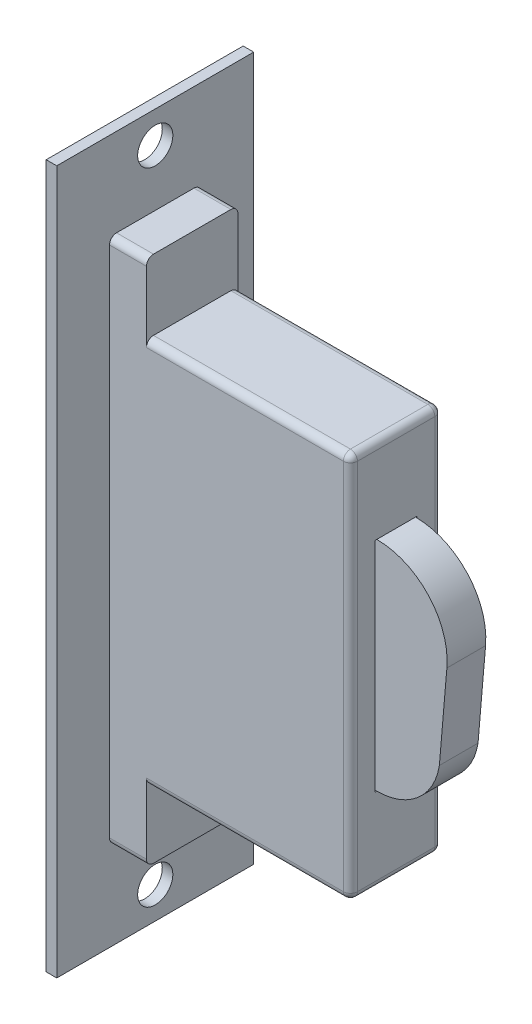
from build123d import *

# Parameters (mm, degrees)
EXTRUDE_1_DEPTH     = 6.5
SKETCH_2_W          = 28
SKETCH_2_H          = 100
SKETCH_2_R          = 2.5
EXTRUDE_2_DEPTH     = 0.75
SKETCH_3_W          = 6
SKETCH_3_H          = 31
CUT_EXTRUDE_1_DEPTH = 5
SKETCH_4_W          = 13.5
SKETCH_4_H          = 5.5
CUT_EXTRUDE_2_DEPTH = 5
EXTRUDE_3_DEPTH     = 2.75
FILLET_1_R          = 1
FILLET_2_R          = 1


with BuildPart() as part:
    # 草图1 → 凸台-拉伸1 (new, symmetric)
    with BuildSketch(Plane.XY):
        Polygon((0, 1.01114255), (0, 0), (35, 0), (35, 27.496864511), (6, 27.496864511), (6, 37.5), (0, 37.5), align=None)
        Polygon((35, 0), (0, 0), (0, -1.01114255), (0, -37.5), (6, -37.5), (6, -27.496864511), (35, -27.496864511), align=None)
    extrude(amount=EXTRUDE_1_DEPTH, both=True)

    # 草图2 → 凸台-拉伸2 (add, symmetric)
    with BuildSketch(Plane.ZY):
        Rectangle(SKETCH_2_W, SKETCH_2_H)
        with Locations(Location((0, -45.5, 0), (0, 0, 270))):
            Circle(SKETCH_2_R, mode=Mode.SUBTRACT)
        with Locations(Location((0, 45.5, 0), (0, 0, 90))):
            Circle(SKETCH_2_R, mode=Mode.SUBTRACT)
    extrude(amount=EXTRUDE_2_DEPTH, both=True)

    # 草图3 → 切除-拉伸1 (cut)
    with BuildSketch(Plane(origin=(35, 0, 0), x_dir=(0, 0, -1), z_dir=(1, 0, 0))):
        Rectangle(SKETCH_3_W, SKETCH_3_H)
    extrude(amount=-CUT_EXTRUDE_1_DEPTH, mode=Mode.SUBTRACT)

    # 草图4 → 切除-拉伸2 (cut)
    with BuildSketch(Plane.XZ.offset(27.496864511)):
        with Locations((21.75, 0)):
            Rectangle(SKETCH_4_W, SKETCH_4_H)
    extrude(amount=-CUT_EXTRUDE_2_DEPTH, mode=Mode.SUBTRACT)

    # 草图5 → 凸台-拉伸3 (add, symmetric)
    with BuildSketch(Plane.XY):
        with BuildLine():
            Line((30, -15.5), (30, 15.5))
            Line((30, 15.5), (35, 15.5))
            ThreePointArc((35, 15.5), (42.36590029, 12.263395074), (44.963698746, 4.648702584))
            Line((44.963698746, 4.648702584), (43.892853324, -7.884615385))
            ThreePointArc((43.892853324, -7.884615385), (40.85399272, -13.335990728), (35, -15.5))
            Line((35, -15.5), (30, -15.5))
        make_face()
    extrude(amount=EXTRUDE_3_DEPTH, both=True)

    # 圆角1
    fillet_1_edges = [part.edges().sort_by_distance(p)[0] for p in [
        (3.375, -37.5, 6.5),
        (3.375, -37.5, -6.5),
        (3.375, 37.5, 6.5),
        (3.375, 37.5, -6.5),
    ]]
    fillet(fillet_1_edges, radius=FILLET_1_R)

    # 圆角2
    fillet_2_edges = [part.edges().sort_by_distance(p)[0] for p in [
        (20.5, 27.496864511, -6.5),
        (35, 0, -6.5),
        (20.5, -27.496864511, -6.5),
        (35, 27.496864511, 0),
        (35, -27.496864511, 0),
        (20.5, -27.496864511, 6.5),
        (35, 0, 6.5),
        (20.5, 27.496864511, 6.5),
    ]]
    fillet(fillet_2_edges, radius=FILLET_2_R)


solid = part.part
